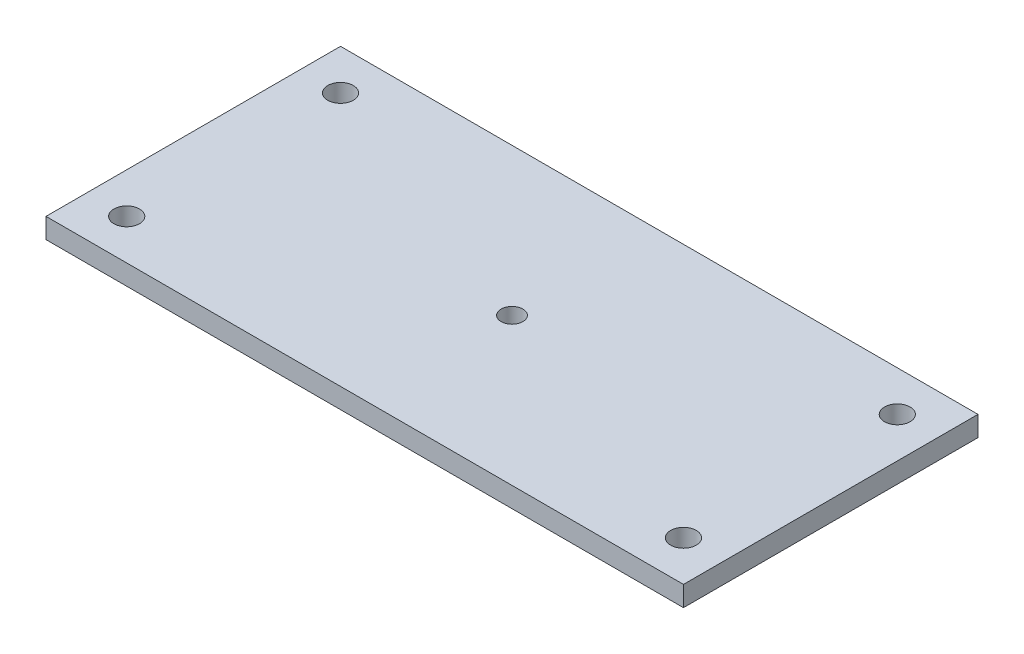
from build123d import *

# Parameters (mm, degrees)
SKETCH1_W                   = 158
SKETCH1_H                   = 73
RIGHT_WALL_DEPTH            = 5
F_1_4_0_2500_DOWEL_HOLE1_D  = 6.35
TAP_DRILL_FOR_1_4_28_TAP2_D = 5.4102


with BuildPart() as part:
    # Sketch1 → right wall (new body)
    with BuildSketch(Plane(origin=(0, 0, 0), x_dir=(1, 0, 0), z_dir=(0, 1, 0))):
        with Locations((79, 36.5)):
            Rectangle(SKETCH1_W, SKETCH1_H)
    extrude(amount=RIGHT_WALL_DEPTH)

    # 1/4 (0.2500) Dowel Hole1 (through all)
    with Locations(Plane(origin=(0, 0, 0), x_dir=(-1, 0, 0), z_dir=(0, -1, 0))):
        with Locations((-10, 10), (-10, 63), (-148, 63), (-148, 10)):
            Hole(F_1_4_0_2500_DOWEL_HOLE1_D / 2)

    # Tap Drill for 1/4-28 Tap2 (through all)
    with Locations(Plane(origin=(0, 0, 0), x_dir=(-1, 0, 0), z_dir=(0, -1, 0))):
        with Locations((-79, 36.5)):
            Hole(TAP_DRILL_FOR_1_4_28_TAP2_D / 2)


solid = part.part
